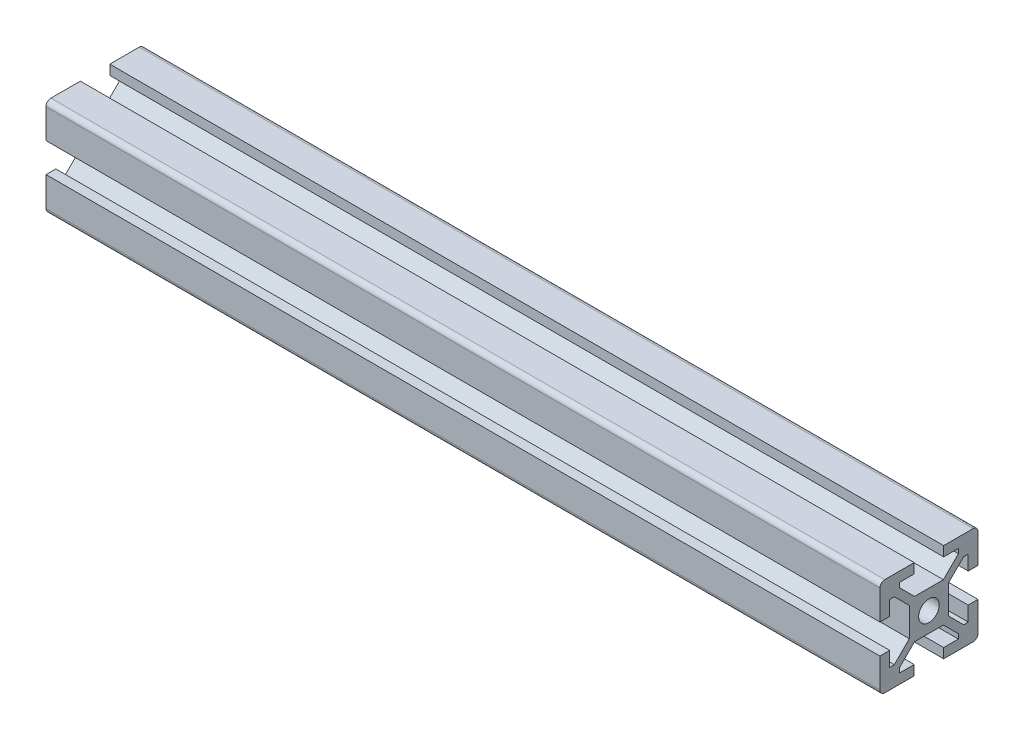
from build123d import *

# Parameters (mm, degrees)
SKETCH1_R           = 2.1
BOSS_EXTRUDE1_DEPTH = 170


with BuildPart() as part:
    # Sketch1 → Boss-Extrude1 (new body)
    with BuildSketch(Plane(origin=(0, 0, 0), x_dir=(0, 0, -1), z_dir=(1, 0, 0))):
        with BuildLine():
            Line((-10, 9), (-10, 3))
            Line((-10, 3), (-8, 3))
            Line((-8, 3), (-8, 6))
            Line((-8, 6), (-7.060660172, 6))
            Line((-7.060660172, 6), (-4, 2.939339828))
            Line((-4, 2.939339828), (-4, -2.939339828))
            Line((-4, -2.939339828), (-7.060660172, -6))
            Line((-7.060660172, -6), (-8, -6))
            Line((-8, -6), (-8, -3))
            Line((-8, -3), (-10, -3))
            Line((-10, -3), (-10, -9))
            ThreePointArc((-10, -9), (-9.707106781, -9.707106781), (-9, -10))
            Line((-9, -10), (-3, -10))
            Line((-3, -10), (-3, -8))
            Line((-3, -8), (-6, -8))
            Line((-6, -8), (-6, -7.060660172))
            Line((-6, -7.060660172), (-2.939339828, -4))
            Line((-2.939339828, -4), (2.939339828, -4))
            Line((2.939339828, -4), (6, -7.060660172))
            Line((6, -7.060660172), (6, -8))
            Line((6, -8), (3, -8))
            Line((3, -8), (3, -10))
            Line((3, -10), (9, -10))
            ThreePointArc((9, -10), (9.707106781, -9.707106781), (10, -9))
            Line((10, -9), (10, -3))
            Line((10, -3), (8, -3))
            Line((8, -3), (8, -6))
            Line((8, -6), (7.060660172, -6))
            Line((7.060660172, -6), (4, -2.939339828))
            Line((4, -2.939339828), (4, 2.939339828))
            Line((4, 2.939339828), (7.060660172, 6))
            Line((7.060660172, 6), (8, 6))
            Line((8, 6), (8, 3))
            Line((8, 3), (10, 3))
            Line((10, 3), (10, 9))
            ThreePointArc((10, 9), (9.707106781, 9.707106781), (9, 10))
            Line((9, 10), (3, 10))
            Line((3, 10), (3, 8))
            Line((3, 8), (6, 8))
            Line((6, 8), (6, 7.060660172))
            Line((6, 7.060660172), (2.939339828, 4))
            Line((2.939339828, 4), (-2.939339828, 4))
            Line((-2.939339828, 4), (-6, 7.060660172))
            Line((-6, 7.060660172), (-6, 8))
            Line((-6, 8), (-3, 8))
            Line((-3, 8), (-3, 10))
            Line((-3, 10), (-9, 10))
            ThreePointArc((-9, 10), (-9.707106781, 9.707106781), (-10, 9))
        make_face()
        Circle(SKETCH1_R, mode=Mode.SUBTRACT)
    extrude(amount=BOSS_EXTRUDE1_DEPTH)


solid = part.part
